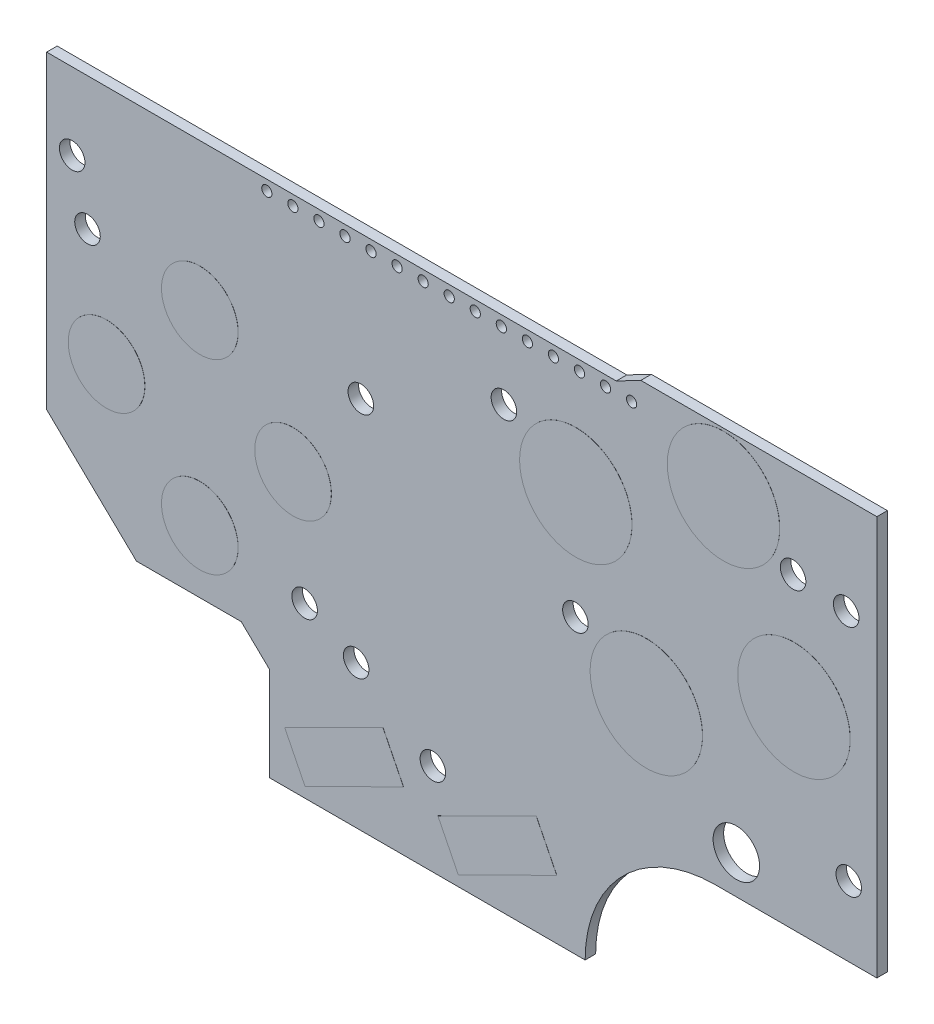
from build123d import *

# Parameters (mm, degrees)
BOSS_EXTRUDE1_DEPTH = 0.515
SKETCH2_R           = 5.5
BOSS_EXTRUDE2_DEPTH = 0.01
SKETCH3_R           = 3.75
BOSS_EXTRUDE5_DEPTH = 0.525
BOSS_EXTRUDE6_DEPTH = 0.01
SKETCH6_R           = 0.5
CUT_EXTRUDE1_DEPTH  = 96.72347361
LPATTERN1_COUNT     = 15
LPATTERN1_PITCH     = 2.55
SKETCH7_R           = 2.275
SKETCH7_R_2         = 1.25
CUT_EXTRUDE2_DEPTH  = 96.72347361
SKETCH8_R           = 1.25
CUT_EXTRUDE3_DEPTH  = 96.72347361
SKETCH9_R           = 1.25
CUT_EXTRUDE4_DEPTH  = 96.72347361
SKETCH10_R          = 1.25
CUT_EXTRUDE5_DEPTH  = 96.72347361
SKETCH11_R          = 1.25
CUT_EXTRUDE6_DEPTH  = 96.72347361
SKETCH12_R          = 1.25
CUT_EXTRUDE7_DEPTH  = 96.72347361
SKETCH13_R          = 1.25
CUT_EXTRUDE8_DEPTH  = 96.72347361
SKETCH14_R          = 1.25
CUT_EXTRUDE9_DEPTH  = 96.72347361
SKETCH15_R          = 1.25
CUT_EXTRUDE10_DEPTH = 96.72347361
SKETCH16_R          = 1.25
CUT_EXTRUDE11_DEPTH = 96.72347361
SKETCH17_R          = 1.25
CUT_EXTRUDE12_DEPTH = 96.72347361


with BuildPart() as part:
    # Sketch1 → Boss-Extrude1 (new, symmetric)
    with BuildSketch(Plane.XY):
        with BuildLine():
            Line((0, 0), (55.75, 0))
            Line((55.75, 0), (58.15, 1.25))
            Line((58.15, 1.25), (81.25, 1.25))
            Line((81.25, 1.25), (81.25, -37.85))
            Line((81.25, -37.85), (65.45, -37.85))
            ThreePointArc((65.45, -37.85), (56.43438854, -41.58438854), (52.7, -50.6))
            Line((52.7, -50.6), (21.8, -50.6))
            Line((21.8, -50.6), (21.8, -41.4))
            Line((21.8, -41.4), (19.042567568, -38.75))
            Line((19.042567568, -38.75), (8.792567568, -38.75))
            Line((8.792567568, -38.75), (0, -30.3))
            Line((0, -30.3), (0, 0))
        make_face()
    extrude(amount=BOSS_EXTRUDE1_DEPTH, both=True)

    # Sketch2 → Boss-Extrude2 (add)
    with BuildSketch(Plane.XY.offset(0.515)):
        with Locations(Location((66.25, -4.5, 0), (0, 0, 180))):
            Circle(SKETCH2_R)
        with Locations(Location((73.15, -18.935719587, 0), (0, 0, 180))):
            Circle(SKETCH2_R)
        with Locations(Location((58.696235763, -25.844344587, 0), (0, 0, 180))):
            Circle(SKETCH2_R)
        with Locations(Location((51.796235763, -11.408625, 0), (0, 0, 180))):
            Circle(SKETCH2_R)
    extrude(amount=BOSS_EXTRUDE2_DEPTH)

    # Sketch3 → Boss-Extrude5 (add, through all)
    with BuildSketch(Plane.XY):
        with Locations((15, -14.375)):
            Circle(SKETCH3_R)
        with Locations((15, -32.625)):
            Circle(SKETCH3_R)
        with Locations((24.125, -23.5)):
            Circle(SKETCH3_R)
        with Locations((5.875, -23.5)):
            Circle(SKETCH3_R)
    extrude(amount=BOSS_EXTRUDE5_DEPTH)

    # Sketch5 → Boss-Extrude6 (add)
    with BuildSketch(Plane.XY.offset(0.515)):
        Polygon((32.918861679, -40.773499762), (23.3, -45.573499762), (25.309302326, -49.6), (34.928164005, -44.8), align=None)
        Polygon((38.3, -45.573499762), (40.309302326, -49.6), (49.928164005, -44.8), (47.918861679, -40.773499762), align=None)
    extrude(amount=BOSS_EXTRUDE6_DEPTH)

    # Sketch6 → Cut-Extrude1 (cut, through all)
    with BuildSketch(Plane.XY.offset(0.515)):
        with Locations((57.25, -1)):
            Circle(SKETCH6_R)
    cut_extrude1 = extrude(amount=-CUT_EXTRUDE1_DEPTH, mode=Mode.SUBTRACT)

    # LPattern1: Cut-Extrude1 ×15
    with Locations(*[(-i * LPATTERN1_PITCH, 0, 0) for i in range(1, LPATTERN1_COUNT)]):
        add(cut_extrude1, mode=Mode.SUBTRACT)

    # Sketch7 → Cut-Extrude2 (cut, through all)
    with BuildSketch(Plane.XY.offset(0.515)):
        with Locations((67.5, -34.1)):
            Circle(SKETCH7_R)
        with Locations((78.5, -31)):
            Circle(SKETCH7_R_2)
    extrude(amount=-CUT_EXTRUDE2_DEPTH, mode=Mode.SUBTRACT)

    # Sketch8 → Cut-Extrude3 (cut, through all)
    with BuildSketch(Plane.XY.offset(0.515)):
        with Locations((78.25, -8.25)):
            Circle(SKETCH8_R)
    extrude(amount=-CUT_EXTRUDE3_DEPTH, mode=Mode.SUBTRACT)

    # Sketch9 → Cut-Extrude4 (cut, through all)
    with BuildSketch(Plane.XY.offset(0.515)):
        with Locations((73.05, -7.75)):
            Circle(SKETCH9_R)
    extrude(amount=-CUT_EXTRUDE4_DEPTH, mode=Mode.SUBTRACT)

    # Sketch10 → Cut-Extrude5 (cut, through all)
    with BuildSketch(Plane.XY.offset(0.515)):
        with Locations((44.75, -7.5)):
            Circle(SKETCH10_R)
    extrude(amount=-CUT_EXTRUDE5_DEPTH, mode=Mode.SUBTRACT)

    # Sketch11 → Cut-Extrude6 (cut, through all)
    with BuildSketch(Plane.XY.offset(0.515)):
        with Locations((51.75, -22)):
            Circle(SKETCH11_R)
    extrude(amount=-CUT_EXTRUDE6_DEPTH, mode=Mode.SUBTRACT)

    # Sketch12 → Cut-Extrude7 (cut, through all)
    with BuildSketch(Plane.XY.offset(0.515)):
        with Locations((37.8, -41.6)):
            Circle(SKETCH12_R)
    extrude(amount=-CUT_EXTRUDE7_DEPTH, mode=Mode.SUBTRACT)

    # Sketch13 → Cut-Extrude8 (cut, through all)
    with BuildSketch(Plane.XY.offset(0.515)):
        with Locations((30.292567568, -36.6)):
            Circle(SKETCH13_R)
    extrude(amount=-CUT_EXTRUDE8_DEPTH, mode=Mode.SUBTRACT)

    # Sketch14 → Cut-Extrude9 (cut, through all)
    with BuildSketch(Plane.XY.offset(0.515)):
        with Locations((25.25, -34.1)):
            Circle(SKETCH14_R)
    extrude(amount=-CUT_EXTRUDE9_DEPTH, mode=Mode.SUBTRACT)

    # Sketch15 → Cut-Extrude10 (cut, through all)
    with BuildSketch(Plane.XY.offset(0.515)):
        with Locations((30.75, -14)):
            Circle(SKETCH15_R)
    extrude(amount=-CUT_EXTRUDE10_DEPTH, mode=Mode.SUBTRACT)

    # Sketch16 → Cut-Extrude11 (cut, through all)
    with BuildSketch(Plane.XY.offset(0.515)):
        with Locations((2.5, -7.5)):
            Circle(SKETCH16_R)
    extrude(amount=-CUT_EXTRUDE11_DEPTH, mode=Mode.SUBTRACT)

    # Sketch17 → Cut-Extrude12 (cut, through all)
    with BuildSketch(Plane.XY.offset(0.515)):
        with Locations((4, -13)):
            Circle(SKETCH17_R)
    extrude(amount=-CUT_EXTRUDE12_DEPTH, mode=Mode.SUBTRACT)


solid = part.part
